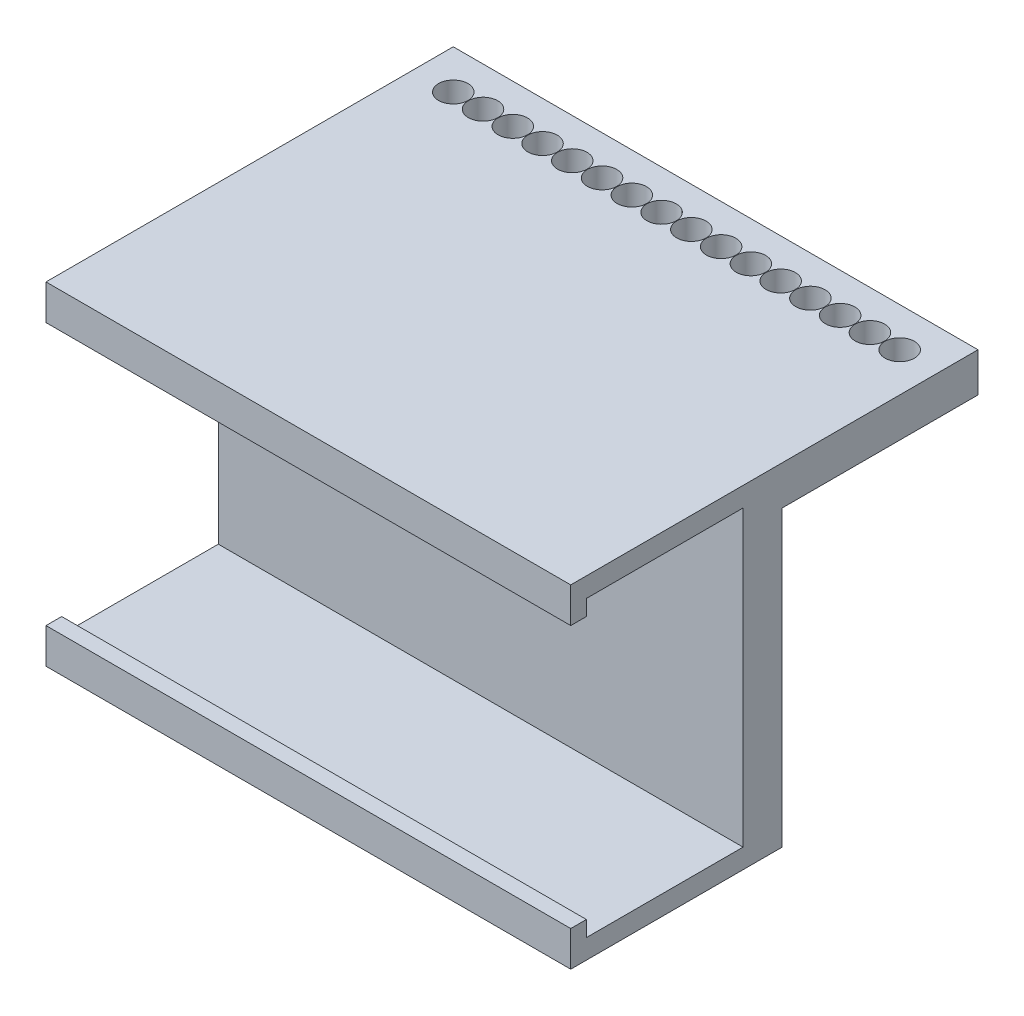
from build123d import *

# Parameters (mm, degrees)
SKETCH1_W           = 85.09
SKETCH1_H           = 38.1
SKETCH1_R           = 2.38125
BOSS_EXTRUDE1_DEPTH = 6.35
SKETCH2_W           = 85.09
SKETCH2_H           = 6.35
BOSS_EXTRUDE2_DEPTH = 47.625
SKETCH3_W           = 85.09
SKETCH3_H           = 3.175
BOSS_EXTRUDE3_DEPTH = 27.94
SKETCH4_W           = 2.54
SKETCH4_H           = 2.54
BOSS_EXTRUDE4_DEPTH = 85.09


with BuildPart() as part:
    # Sketch1 → Boss-Extrude1 (new body)
    with BuildSketch(Plane(origin=(0, 0, 0), x_dir=(1, 0, 0), z_dir=(0, 1, 0))):
        with Locations((-45.836632653, -8.617857143)):
            Rectangle(SKETCH1_W, SKETCH1_H)
        with Locations(Location((-82.031632653, 4.082142857, 0), (0, 0, 270))):
            Circle(SKETCH1_R, mode=Mode.SUBTRACT)
        with Locations(Location((-77.205632653, 4.082142857, 0), (0, 0, 270))):
            Circle(SKETCH1_R, mode=Mode.SUBTRACT)
        with Locations(Location((-72.379632653, 4.082142857, 0), (0, 0, 270))):
            Circle(SKETCH1_R, mode=Mode.SUBTRACT)
        with Locations(Location((-67.553632653, 4.082142857, 0), (0, 0, 270))):
            Circle(SKETCH1_R, mode=Mode.SUBTRACT)
        with Locations(Location((-62.727632653, 4.082142857, 0), (0, 0, 270))):
            Circle(SKETCH1_R, mode=Mode.SUBTRACT)
        with Locations(Location((-57.901632653, 4.082142857, 0), (0, 0, 270))):
            Circle(SKETCH1_R, mode=Mode.SUBTRACT)
        with Locations(Location((-53.075632653, 4.082142857, 0), (0, 0, 270))):
            Circle(SKETCH1_R, mode=Mode.SUBTRACT)
        with Locations(Location((-48.249632653, 4.082142857, 0), (0, 0, 270))):
            Circle(SKETCH1_R, mode=Mode.SUBTRACT)
        with Locations(Location((-43.423632653, 4.082142857, 0), (0, 0, 270))):
            Circle(SKETCH1_R, mode=Mode.SUBTRACT)
        with Locations(Location((-38.597632653, 4.082142857, 0), (0, 0, 270))):
            Circle(SKETCH1_R, mode=Mode.SUBTRACT)
        with Locations(Location((-33.771632653, 4.082142857, 0), (0, 0, 270))):
            Circle(SKETCH1_R, mode=Mode.SUBTRACT)
        with Locations(Location((-28.945632653, 4.082142857, 0), (0, 0, 270))):
            Circle(SKETCH1_R, mode=Mode.SUBTRACT)
        with Locations(Location((-24.119632653, 4.082142857, 0), (0, 0, 270))):
            Circle(SKETCH1_R, mode=Mode.SUBTRACT)
        with Locations(Location((-19.293632653, 4.082142857, 0), (0, 0, 270))):
            Circle(SKETCH1_R, mode=Mode.SUBTRACT)
        with Locations(Location((-14.467632653, 4.082142857, 0), (0, 0, 270))):
            Circle(SKETCH1_R, mode=Mode.SUBTRACT)
        with Locations(Location((-9.641632653, 4.082142857, 0), (0, 0, 270))):
            Circle(SKETCH1_R, mode=Mode.SUBTRACT)
    extrude(amount=BOSS_EXTRUDE1_DEPTH)

    # Sketch2 → Boss-Extrude2 (add)
    with BuildSketch(Plane.XZ):
        with Locations((-45.836632653, 24.492857143)):
            Rectangle(SKETCH2_W, SKETCH2_H)
    extrude(amount=BOSS_EXTRUDE2_DEPTH)

    # Sketch3 → Boss-Extrude3 (add)
    with BuildSketch(Plane.XY.offset(27.667857143)):
        with Locations((-45.836632653, 4.7625)):
            Rectangle(SKETCH3_W, SKETCH3_H)
        with Locations((-45.836632653, -46.0375)):
            Rectangle(SKETCH3_W, SKETCH3_H)
    extrude(amount=BOSS_EXTRUDE3_DEPTH)

    # Sketch4 → Boss-Extrude4 (add)
    with BuildSketch(Plane(origin=(-3.291632653, 0, 0), x_dir=(0, 0, -1), z_dir=(1, 0, 0))):
        with Locations((-54.337857143, 1.905)):
            Rectangle(SKETCH4_W, SKETCH4_H)
        with Locations((-54.337857143, -43.18)):
            Rectangle(SKETCH4_W, SKETCH4_H)
    extrude(amount=-BOSS_EXTRUDE4_DEPTH)


solid = part.part
